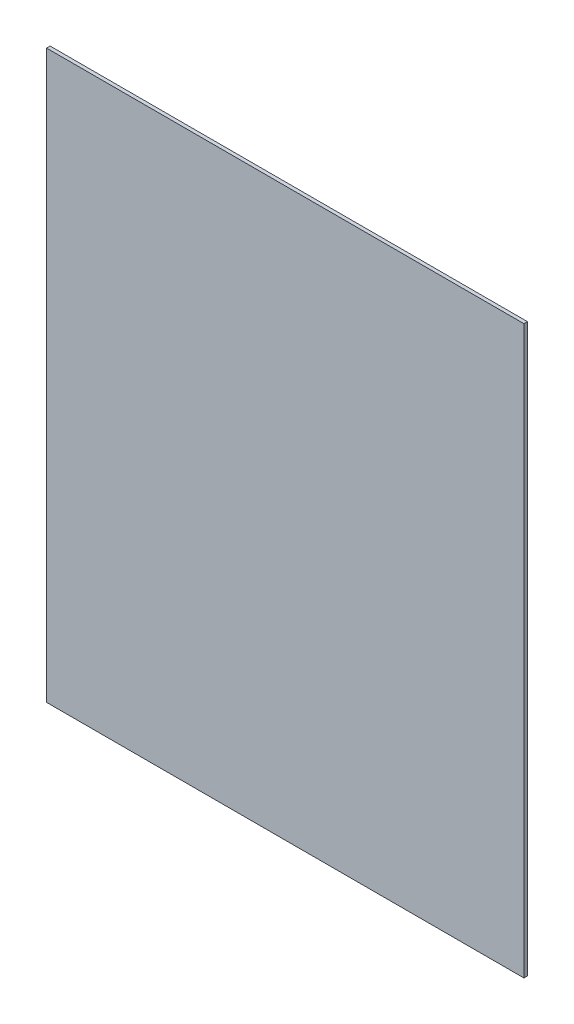
from build123d import *

# Parameters (mm, degrees)
SKETCH1_W           = 427.99
SKETCH1_H           = 508
BOSS_EXTRUDE1_DEPTH = 3.175


with BuildPart() as part:
    # Sketch1 → Boss-Extrude1 (new body)
    with BuildSketch(Plane.XY):
        with Locations((213.995, 254)):
            Rectangle(SKETCH1_W, SKETCH1_H)
    extrude(amount=BOSS_EXTRUDE1_DEPTH)


solid = part.part
